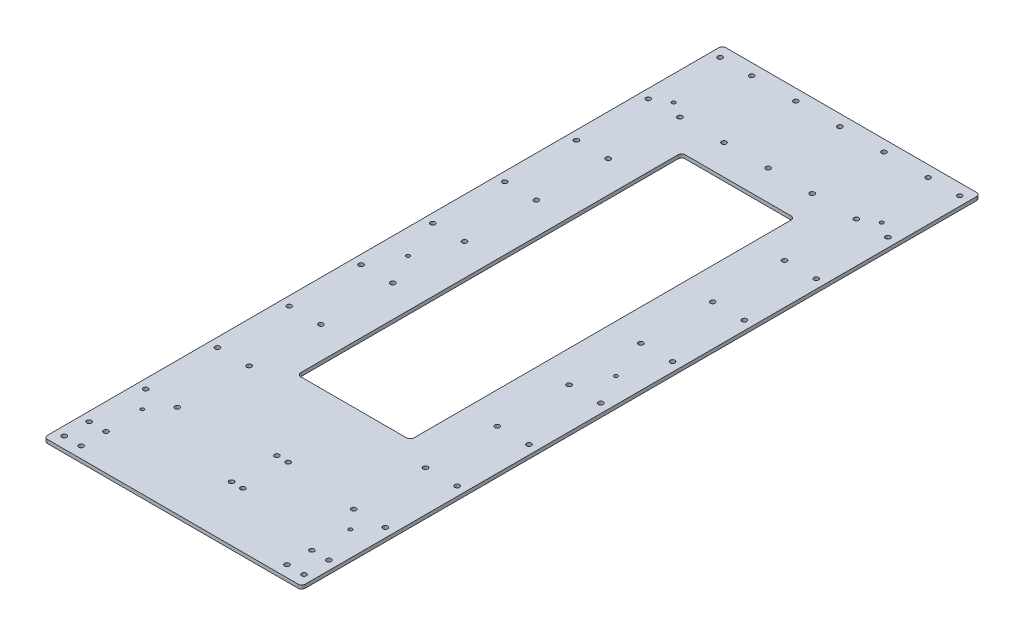
from build123d import *

# Parameters (mm, degrees)
SKETCH1_W           = 228
SKETCH1_H           = 600
SKETCH1_R           = 2.1
SKETCH1_R_2         = 1.6
SKETCH1_W_2         = 100
SKETCH1_H_2         = 340
BOSS_EXTRUDE1_DEPTH = 3.175
FILLET1_R           = 3.2


with BuildPart() as part:
    # Sketch1 → Boss-Extrude1 (new body)
    with BuildSketch(Plane(origin=(0, 0, 0), x_dir=(1, 0, 0), z_dir=(0, 1, 0))):
        Rectangle(SKETCH1_W, SKETCH1_H)
        with Locations(Location((106, 290, 0), (0, 0, 270))):
            Circle(SKETCH1_R, mode=Mode.SUBTRACT)
        with Locations(Location((106, -290, 0), (0, 0, 270))):
            Circle(SKETCH1_R, mode=Mode.SUBTRACT)
        with Locations(Location((78, 290, 0), (0, 0, 90))):
            Circle(SKETCH1_R, mode=Mode.SUBTRACT)
        with Locations(Location((92, 0, 0), (0, 0, 270))):
            Circle(SKETCH1_R_2, mode=Mode.SUBTRACT)
        with Locations(Location((92, 235, 0), (0, 0, 270))):
            Circle(SKETCH1_R_2, mode=Mode.SUBTRACT)
        with Locations(Location((92, -235, 0), (0, 0, 90))):
            Circle(SKETCH1_R_2, mode=Mode.SUBTRACT)
        with Locations(Location((-92, -235, 0), (0, 0, 270))):
            Circle(SKETCH1_R_2, mode=Mode.SUBTRACT)
        with Locations(Location((-106, -290, 0), (0, 0, 90))):
            Circle(SKETCH1_R, mode=Mode.SUBTRACT)
        with Locations(Location((91, -290, 0), (0, 0, 270))):
            Circle(SKETCH1_R, mode=Mode.SUBTRACT)
        with Locations(Location((91, -268, 0), (0, 0, 90))):
            Circle(SKETCH1_R, mode=Mode.SUBTRACT)
        with Locations(Location((106, -268, 0), (0, 0, 90))):
            Circle(SKETCH1_R, mode=Mode.SUBTRACT)
        with Locations(Location((-91, -290, 0), (0, 0, 90))):
            Circle(SKETCH1_R, mode=Mode.SUBTRACT)
        with Locations(Location((-106, -268, 0), (0, 0, 270))):
            Circle(SKETCH1_R, mode=Mode.SUBTRACT)
        with Locations(Location((-91, -268, 0), (0, 0, 270))):
            Circle(SKETCH1_R, mode=Mode.SUBTRACT)
        with Locations(Location((13, -251, 0), (0, 0, 270))):
            Circle(SKETCH1_R, mode=Mode.SUBTRACT)
        with Locations(Location((3, -251, 0), (0, 0, 270))):
            Circle(SKETCH1_R, mode=Mode.SUBTRACT)
        with Locations(Location((13, -211, 0), (0, 0, 90))):
            Circle(SKETCH1_R, mode=Mode.SUBTRACT)
        with Locations(Location((3, -211, 0), (0, 0, 90))):
            Circle(SKETCH1_R, mode=Mode.SUBTRACT)
        with Locations(Location((-39, 290, 0), (0, 0, 270))):
            Circle(SKETCH1_R, mode=Mode.SUBTRACT)
        with Locations(Location((-39, 226.5, 0), (0, 0, 270))):
            Circle(SKETCH1_R, mode=Mode.SUBTRACT)
        with Locations(Location((106, 226.5, 0), (0, 0, 270))):
            Circle(SKETCH1_R, mode=Mode.SUBTRACT)
        with Locations(Location((106, 163, 0), (0, 0, 270))):
            Circle(SKETCH1_R, mode=Mode.SUBTRACT)
        with Locations(Location((106, 99.5, 0), (0, 0, 270))):
            Circle(SKETCH1_R, mode=Mode.SUBTRACT)
        with Locations(Location((106, 36, 0), (0, 0, 270))):
            Circle(SKETCH1_R, mode=Mode.SUBTRACT)
        with Locations(Location((106, -27.5, 0), (0, 0, 270))):
            Circle(SKETCH1_R, mode=Mode.SUBTRACT)
        with Locations(Location((106, -91, 0), (0, 0, 270))):
            Circle(SKETCH1_R, mode=Mode.SUBTRACT)
        with Locations(Location((106, -154.5, 0), (0, 0, 270))):
            Circle(SKETCH1_R, mode=Mode.SUBTRACT)
        with Locations(Location((106, -218, 0), (0, 0, 270))):
            Circle(SKETCH1_R, mode=Mode.SUBTRACT)
        with Locations(Location((78, 226.5, 0), (0, 0, 90))):
            Circle(SKETCH1_R, mode=Mode.SUBTRACT)
        with Locations(Location((78, 163, 0), (0, 0, 90))):
            Circle(SKETCH1_R, mode=Mode.SUBTRACT)
        with Locations(Location((78, 99.5, 0), (0, 0, 90))):
            Circle(SKETCH1_R, mode=Mode.SUBTRACT)
        with Locations(Location((78, 36, 0), (0, 0, 90))):
            Circle(SKETCH1_R, mode=Mode.SUBTRACT)
        with Locations(Location((78, -27.5, 0), (0, 0, 90))):
            Circle(SKETCH1_R, mode=Mode.SUBTRACT)
        with Locations(Location((78, -91, 0), (0, 0, 90))):
            Circle(SKETCH1_R, mode=Mode.SUBTRACT)
        with Locations(Location((78, -154.5, 0), (0, 0, 90))):
            Circle(SKETCH1_R, mode=Mode.SUBTRACT)
        with Locations(Location((78, -218, 0), (0, 0, 90))):
            Circle(SKETCH1_R, mode=Mode.SUBTRACT)
        with Locations(Location((-78, -218, 0), (0, 0, 270))):
            Circle(SKETCH1_R, mode=Mode.SUBTRACT)
        with Locations(Location((-78, -154.5, 0), (0, 0, 270))):
            Circle(SKETCH1_R, mode=Mode.SUBTRACT)
        with Locations(Location((-106, -218, 0), (0, 0, 90))):
            Circle(SKETCH1_R, mode=Mode.SUBTRACT)
        with Locations(Location((-106, -154.5, 0), (0, 0, 90))):
            Circle(SKETCH1_R, mode=Mode.SUBTRACT)
        with Locations(Location((-78, -91, 0), (0, 0, 270))):
            Circle(SKETCH1_R, mode=Mode.SUBTRACT)
        with Locations(Location((-78, -27.5, 0), (0, 0, 270))):
            Circle(SKETCH1_R, mode=Mode.SUBTRACT)
        with Locations(Location((-106, -91, 0), (0, 0, 90))):
            Circle(SKETCH1_R, mode=Mode.SUBTRACT)
        with Locations(Location((-106, -27.5, 0), (0, 0, 90))):
            Circle(SKETCH1_R, mode=Mode.SUBTRACT)
        with Locations(Location((-78, 36, 0), (0, 0, 270))):
            Circle(SKETCH1_R, mode=Mode.SUBTRACT)
        with Locations(Location((-78, 99.5, 0), (0, 0, 270))):
            Circle(SKETCH1_R, mode=Mode.SUBTRACT)
        with Locations(Location((-106, 36, 0), (0, 0, 90))):
            Circle(SKETCH1_R, mode=Mode.SUBTRACT)
        with Locations(Location((-106, 99.5, 0), (0, 0, 90))):
            Circle(SKETCH1_R, mode=Mode.SUBTRACT)
        with Locations(Location((-78, 163, 0), (0, 0, 270))):
            Circle(SKETCH1_R, mode=Mode.SUBTRACT)
        with Locations(Location((-106, 163, 0), (0, 0, 90))):
            Circle(SKETCH1_R, mode=Mode.SUBTRACT)
        with Locations(Location((-78, 226.5, 0), (0, 0, 270))):
            Circle(SKETCH1_R, mode=Mode.SUBTRACT)
        with Locations(Location((-106, 226.5, 0), (0, 0, 90))):
            Circle(SKETCH1_R, mode=Mode.SUBTRACT)
        with Locations(Location((-92, 235, 0), (0, 0, 90))):
            Circle(SKETCH1_R_2, mode=Mode.SUBTRACT)
        with Locations(Location((-106, 290, 0), (0, 0, 90))):
            Circle(SKETCH1_R, mode=Mode.SUBTRACT)
        with Locations(Location((-78, 290, 0), (0, 0, 270))):
            Circle(SKETCH1_R, mode=Mode.SUBTRACT)
        with Locations(Location((-92, 0, 0), (0, 0, 90))):
            Circle(SKETCH1_R_2, mode=Mode.SUBTRACT)
        with Locations(Location((0, 290, 0), (0, 0, 270))):
            Circle(SKETCH1_R, mode=Mode.SUBTRACT)
        with Locations(Location((0, 226.5, 0), (0, 0, 270))):
            Circle(SKETCH1_R, mode=Mode.SUBTRACT)
        with Locations(Location((39, 290, 0), (0, 0, 270))):
            Circle(SKETCH1_R, mode=Mode.SUBTRACT)
        with Locations(Location((39, 226.5, 0), (0, 0, 270))):
            Circle(SKETCH1_R, mode=Mode.SUBTRACT)
        with Locations((0, 30)):
            Rectangle(SKETCH1_W_2, SKETCH1_H_2, mode=Mode.SUBTRACT)
    extrude(amount=BOSS_EXTRUDE1_DEPTH)

    # Fillet1
    fillet1_edges = [part.edges().sort_by_distance(p)[0] for p in [
        (50, 1.5875, 140),
        (50, 1.5875, -200),
        (-50, 1.5875, -200),
        (-50, 1.5875, 140),
        (114, 1.5875, 300),
        (-114, 1.5875, 300),
        (-114, 1.5875, -300),
        (114, 1.5875, -300),
    ]]
    fillet(fillet1_edges, radius=FILLET1_R)


solid = part.part
